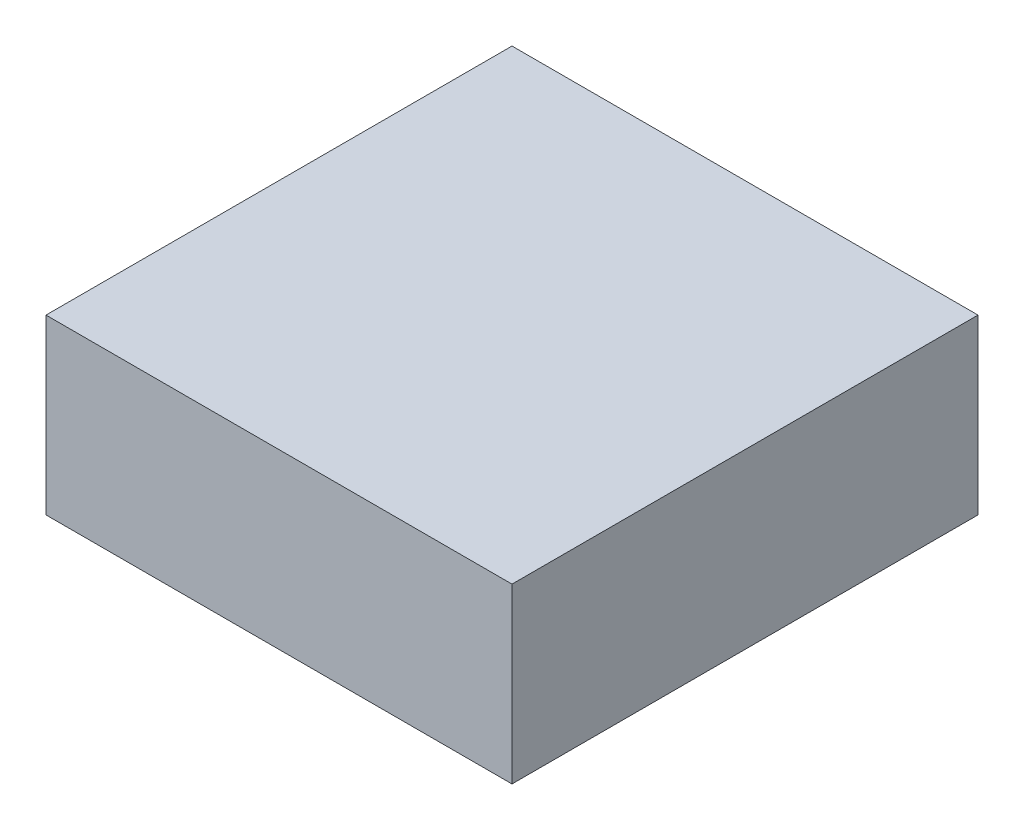
from build123d import *

# Parameters (mm, degrees)
SKETCH2_W           = 70
SKETCH2_H           = 70
BOSS_EXTRUDE1_DEPTH = 26


with BuildPart() as part:
    # Sketch2 → Boss-Extrude1 (new body)
    with BuildSketch(Plane(origin=(0, 0, 0), x_dir=(1, 0, 0), z_dir=(0, 1, 0))):
        Rectangle(SKETCH2_W, SKETCH2_H)
    extrude(amount=BOSS_EXTRUDE1_DEPTH)


solid = part.part
